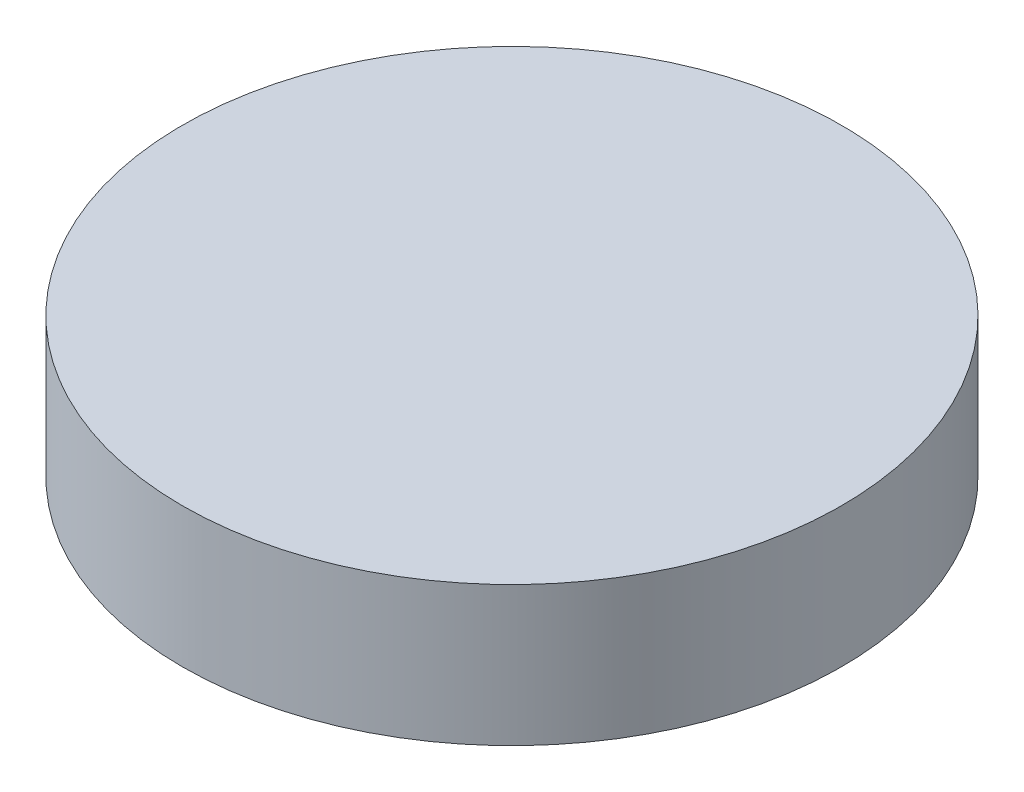
from build123d import *

# Parameters (mm, degrees)
ESQUISSE1_R        = 15
BOSS_EXTRU_1_DEPTH = 6.35


with BuildPart() as part:
    # Esquisse1 → Boss.-Extru.1 (new body)
    with BuildSketch(Plane(origin=(0, 0, 0), x_dir=(1, 0, 0), z_dir=(0, 1, 0))):
        with Locations(Location((0, 0, 0), (0, 0, 270))):
            Circle(ESQUISSE1_R)
    extrude(amount=BOSS_EXTRU_1_DEPTH)


solid = part.part
